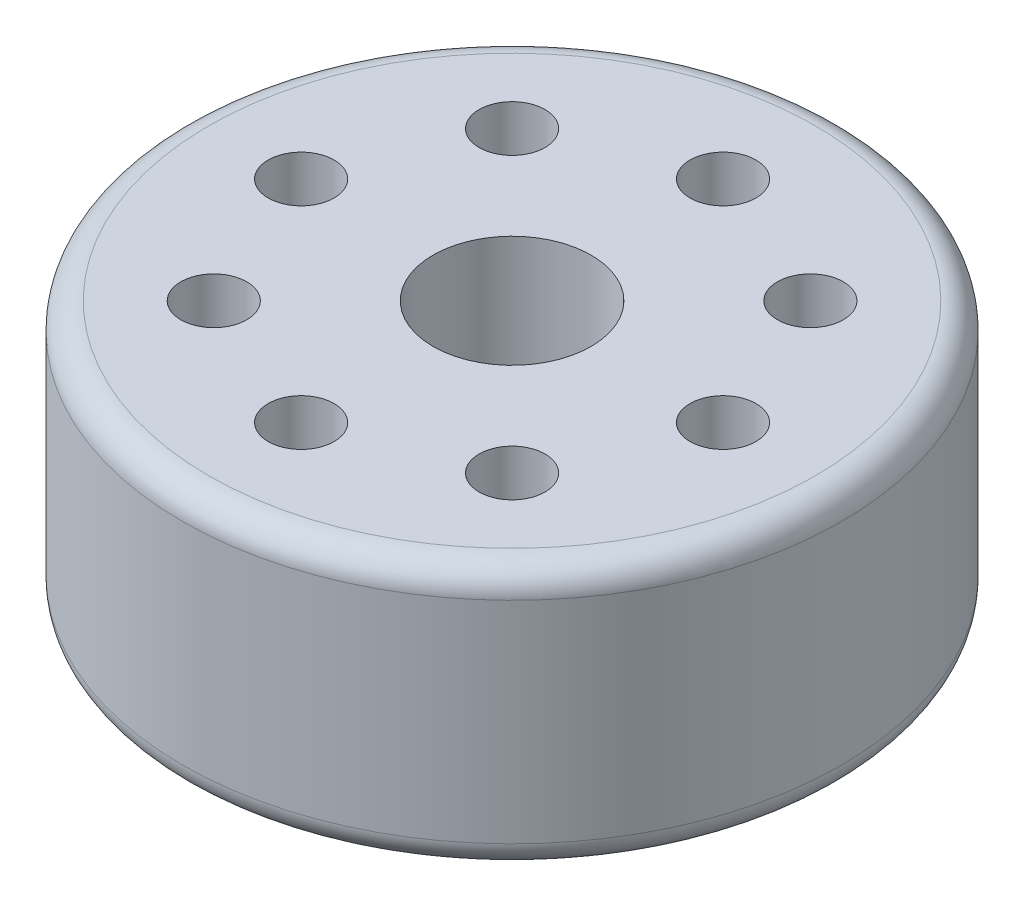
from build123d import *

# Parameters (mm, degrees)
SKETCH1_R           = 12.5
SKETCH1_R_2         = 1.25
SKETCH1_R_3         = 3
BOSS_EXTRUDE1_DEPTH = 10
FILLET1_R           = 1


with BuildPart() as part:
    # Sketch1 → Boss-Extrude1 (new body)
    with BuildSketch(Plane(origin=(0, 0, 0), x_dir=(1, 0, 0), z_dir=(0, 1, 0))):
        with Locations(Location((0, 0, 0), (0, 0, 270))):
            Circle(SKETCH1_R)
        with Locations(Location((0, 8, 0), (0, 0, 270))):
            Circle(SKETCH1_R_2, mode=Mode.SUBTRACT)
        with Locations(Location((5.656854249, 5.656854249, 0), (0, 0, 270))):
            Circle(SKETCH1_R_2, mode=Mode.SUBTRACT)
        with Locations(Location((0, 0, 0), (0, 0, 270))):
            Circle(SKETCH1_R_3, mode=Mode.SUBTRACT)
        with Locations(Location((8, 0, 0), (0, 0, 270))):
            Circle(SKETCH1_R_2, mode=Mode.SUBTRACT)
        with Locations(Location((5.656854249, -5.656854249, 0), (0, 0, 270))):
            Circle(SKETCH1_R_2, mode=Mode.SUBTRACT)
        with Locations(Location((0, -8, 0), (0, 0, 270))):
            Circle(SKETCH1_R_2, mode=Mode.SUBTRACT)
        with Locations(Location((-5.656854249, -5.656854249, 0), (0, 0, 270))):
            Circle(SKETCH1_R_2, mode=Mode.SUBTRACT)
        with Locations(Location((-8, 0, 0), (0, 0, 270))):
            Circle(SKETCH1_R_2, mode=Mode.SUBTRACT)
        with Locations(Location((-5.656854249, 5.656854249, 0), (0, 0, 270))):
            Circle(SKETCH1_R_2, mode=Mode.SUBTRACT)
    extrude(amount=BOSS_EXTRUDE1_DEPTH)

    # Fillet1
    fillet1_edges = [part.edges().sort_by_distance(p)[0] for p in [
        (0, 0, -12.5),
        (0, 10, -12.5),
    ]]
    fillet(fillet1_edges, radius=FILLET1_R)


solid = part.part
